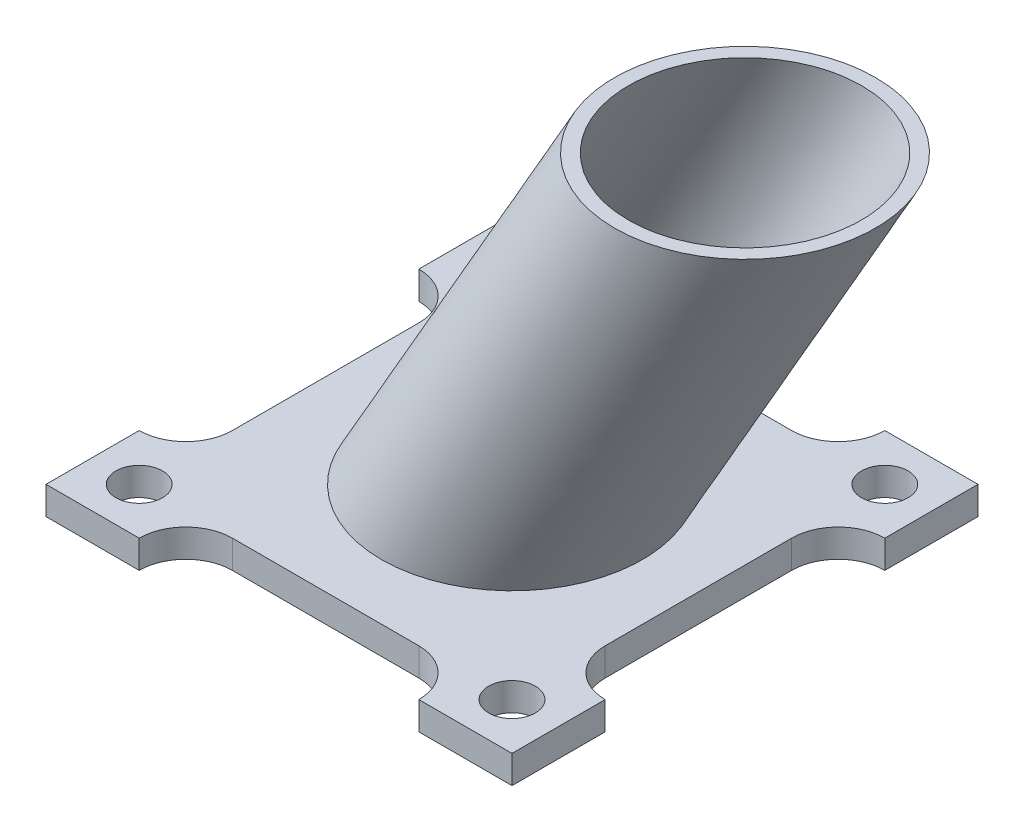
from build123d import *

# Parameters (mm, degrees)
SKETCH1_W           = 50
SKETCH1_H           = 50
BOSS_EXTRUDE1_DEPTH = 3
SKETCH3_R           = 14
SKETCH3_R_2         = 12.5
CUT_EXTRUDE1_REACH  = 65.411
SKETCH4_R           = 2.5
CUT_EXTRUDE2_REACH  = 65.411
CIRPATTERN1_COUNT   = 4


with BuildPart() as part:
    # Sketch1 → Boss-Extrude1 (new body)
    with BuildSketch(Plane(origin=(0, 0, 0), x_dir=(1, 0, 0), z_dir=(0, 1, 0))):
        Rectangle(SKETCH1_W, SKETCH1_H)
    extrude(amount=BOSS_EXTRUDE1_DEPTH)

    # Sweep1: sweep along a path in Sketch2
    with BuildLine(Plane.XY) as sweep1_path:
        Line((0, 3), (25, 46.301270189))
    # Sketch3 → Sweep1 (sweep)
    with BuildSketch(Plane(origin=(0, 3, 0), x_dir=(1, 0, 0), z_dir=(0, 1, 0))):
        Circle(SKETCH3_R)
        Circle(SKETCH3_R_2, mode=Mode.SUBTRACT)
    sweep(path=sweep1_path.line)

    # Sketch4 → Cut-Extrude1 (cut, up to next)
    with BuildSketch(Plane(origin=(0, 3, 0), x_dir=(1, 0, 0), z_dir=(0, 1, 0)), mode=Mode.PRIVATE) as cut_extrude1_sk1:
        with Locations((-20, 20)):
            Circle(SKETCH4_R)
    cut_extrude1_tool1 = extrude(cut_extrude1_sk1.sketch, amount=-CUT_EXTRUDE1_REACH, mode=Mode.PRIVATE) & part.part
    # Sketch4 → Cut-Extrude1 (cut, up to next)
    with BuildSketch(Plane(origin=(0, 3, 0), x_dir=(1, 0, 0), z_dir=(0, 1, 0)), mode=Mode.PRIVATE) as cut_extrude1_sk2:
        with Locations((20, 20)):
            Circle(SKETCH4_R)
    cut_extrude1_tool2 = extrude(cut_extrude1_sk2.sketch, amount=-CUT_EXTRUDE1_REACH, mode=Mode.PRIVATE) & part.part
    # Sketch4 → Cut-Extrude1 (cut, up to next)
    with BuildSketch(Plane(origin=(0, 3, 0), x_dir=(1, 0, 0), z_dir=(0, 1, 0)), mode=Mode.PRIVATE) as cut_extrude1_sk3:
        with Locations((20, -20)):
            Circle(SKETCH4_R)
    cut_extrude1_tool3 = extrude(cut_extrude1_sk3.sketch, amount=-CUT_EXTRUDE1_REACH, mode=Mode.PRIVATE) & part.part
    # Sketch4 → Cut-Extrude1 (cut, up to next)
    with BuildSketch(Plane(origin=(0, 3, 0), x_dir=(1, 0, 0), z_dir=(0, 1, 0)), mode=Mode.PRIVATE) as cut_extrude1_sk4:
        with Locations((-20, -20)):
            Circle(SKETCH4_R)
    cut_extrude1_tool4 = extrude(cut_extrude1_sk4.sketch, amount=-CUT_EXTRUDE1_REACH, mode=Mode.PRIVATE) & part.part
    add(cut_extrude1_tool1.solids().sort_by_distance((-20, 3, -20))[0], mode=Mode.SUBTRACT)
    add(cut_extrude1_tool2.solids().sort_by_distance((20, 3, -20))[0], mode=Mode.SUBTRACT)
    add(cut_extrude1_tool3.solids().sort_by_distance((20, 3, 20))[0], mode=Mode.SUBTRACT)
    add(cut_extrude1_tool4.solids().sort_by_distance((-20, 3, 20))[0], mode=Mode.SUBTRACT)

    # Sketch5 → Cut-Extrude2 (cut, up to next)
    with BuildSketch(Plane(origin=(0, 3, 0), x_dir=(1, 0, 0), z_dir=(0, 1, 0)), mode=Mode.PRIVATE) as cut_extrude2_sk1:
        with BuildLine():
            Line((-10, 30), (10, 30))
            ThreePointArc((10, 30), (15, 25), (10, 20))
            Line((10, 20), (-10, 20))
            ThreePointArc((-10, 20), (-15, 25), (-10, 30))
        make_face()
    cut_extrude2_tool1 = extrude(cut_extrude2_sk1.sketch, amount=-CUT_EXTRUDE2_REACH, mode=Mode.PRIVATE) & part.part
    cut_extrude2 = cut_extrude2_tool1.solids().sort_by_distance((0, 3, -25))[0]
    add(cut_extrude2, mode=Mode.SUBTRACT)

    # CirPattern1: Cut-Extrude2 ×4 about axis
    cirpattern1_axis = Axis((0, 86.42986483, 0), (0, -1, 0))
    for i in range(1, CIRPATTERN1_COUNT):
        add(cut_extrude2.rotate(cirpattern1_axis, i * 360 / CIRPATTERN1_COUNT), mode=Mode.SUBTRACT)


solid = part.part
